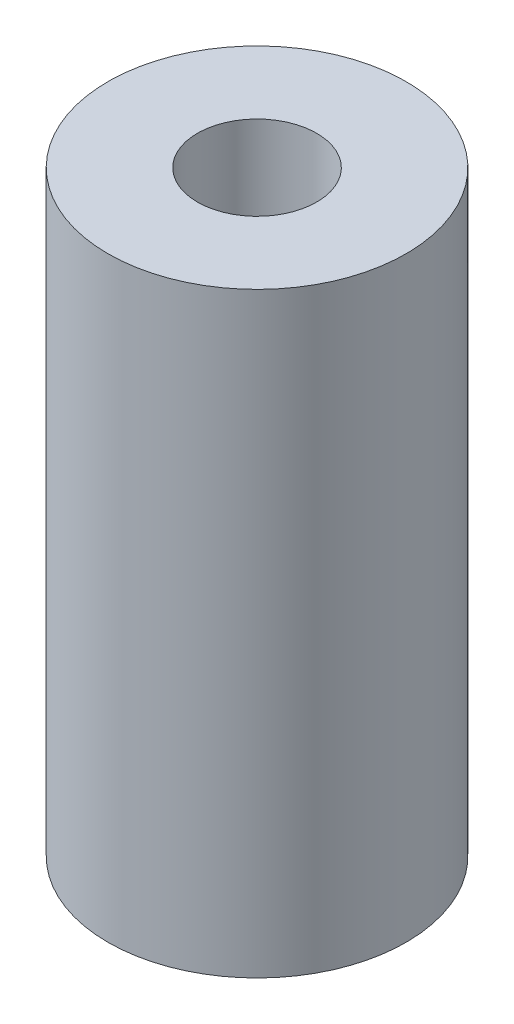
from build123d import *

# Parameters (mm, degrees)
SKETCH1_R           = 5
BOSS_EXTRUDE1_DEPTH = 20
SKETCH2_R           = 2
CUT_EXTRUDE1_DEPTH  = 22.213203436


with BuildPart() as part:
    # Sketch1 → Boss-Extrude1 (new body)
    with BuildSketch(Plane(origin=(0, 0, 0), x_dir=(1, 0, 0), z_dir=(0, 1, 0))):
        with Locations(Location((0, 0, 0), (0, 0, 270))):
            Circle(SKETCH1_R)
    extrude(amount=BOSS_EXTRUDE1_DEPTH)

    # Sketch2 → Cut-Extrude1 (cut, through all)
    with BuildSketch(Plane(origin=(0, 20, 0), x_dir=(1, 0, 0), z_dir=(0, 1, 0))):
        with Locations(Location((0, 0, 0), (0, 0, 270))):
            Circle(SKETCH2_R)
    extrude(amount=-CUT_EXTRUDE1_DEPTH, mode=Mode.SUBTRACT)


solid = part.part
